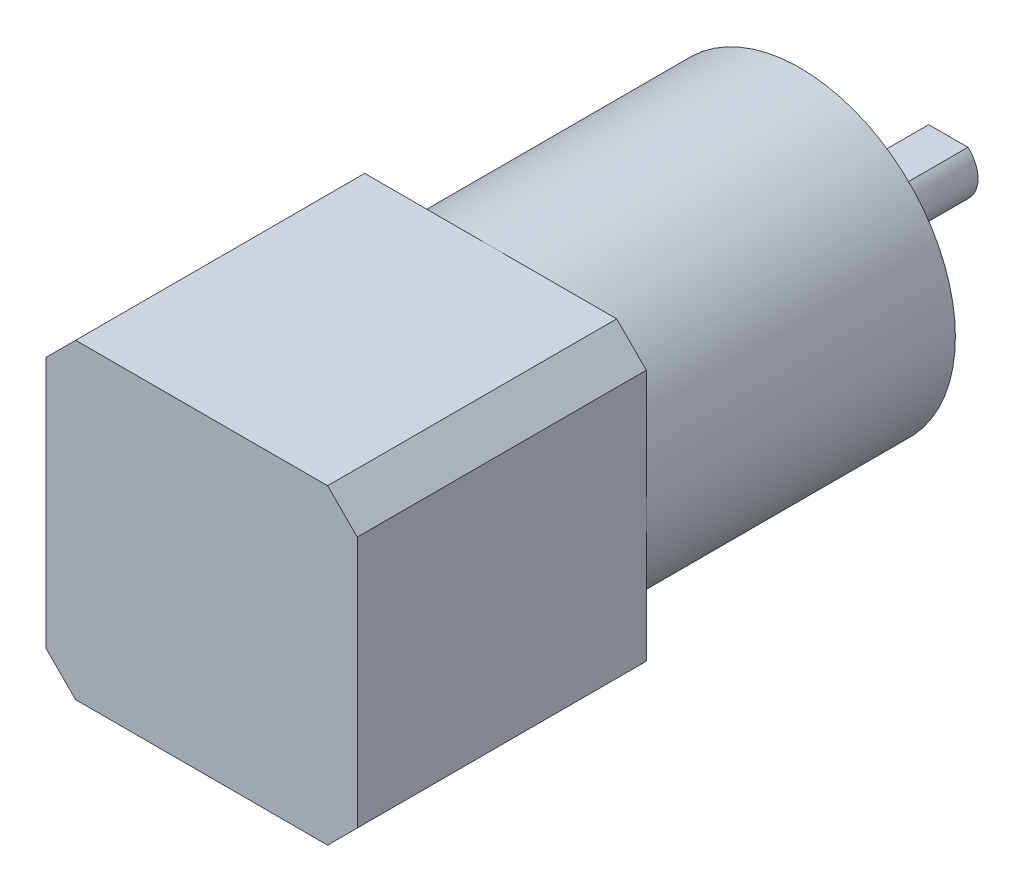
from build123d import *

# Parameters (mm, degrees)
SKETCH1_W           = 42
SKETCH1_H           = 42
BOSS_EXTRUDE1_DEPTH = 39
CHAMFER1_SIZE       = 4
SKETCH2_R           = 20.95
BOSS_EXTRUDE2_DEPTH = 41.75
SKETCH3_R           = 4
BOSS_EXTRUDE3_DEPTH = 20
CUT_EXTRUDE1_START  = -15
CUT_EXTRUDE1_DEPTH  = 15
SKETCH5_R           = 2
CUT_EXTRUDE2_DEPTH  = 20


with BuildPart() as part:
    # Sketch1 → Boss-Extrude1 (new body)
    with BuildSketch(Plane.XY):
        Rectangle(SKETCH1_W, SKETCH1_H)
    extrude(amount=BOSS_EXTRUDE1_DEPTH)

    # Chamfer1
    chamfer1_edges = [part.edges().sort_by_distance(p)[0] for p in [
        (21, -21, 19.5),
        (-21, -21, 19.5),
        (-21, 21, 19.5),
        (21, 21, 19.5),
    ]]
    chamfer(chamfer1_edges, length=CHAMFER1_SIZE)

    # Sketch2 → Boss-Extrude2 (add)
    with BuildSketch(Plane(origin=(0, 0, 0), x_dir=(-1, 0, 0), z_dir=(0, 0, -1))):
        with Locations(Location((0, 0, 0), (0, 0, 180))):
            Circle(SKETCH2_R)
    extrude(amount=BOSS_EXTRUDE2_DEPTH)

    # Sketch3 → Boss-Extrude3 (add)
    with BuildSketch(Plane(origin=(0, 0, -41.75), x_dir=(-1, 0, 0), z_dir=(0, 0, -1))):
        Circle(SKETCH3_R)
    extrude(amount=BOSS_EXTRUDE3_DEPTH)

    # Sketch4 → Cut-Extrude1 (cut)
    with BuildSketch(Plane(origin=(0, 0, -61.75), x_dir=(-1, 0, 0), z_dir=(0, 0, -1)).offset(CUT_EXTRUDE1_START)):
        with BuildLine():
            Line((-2.645751311, 3), (2.645751311, 3))
            ThreePointArc((2.645751311, 3), (0, 4), (-2.645751311, 3))
        make_face()
    extrude(amount=CUT_EXTRUDE1_DEPTH, mode=Mode.SUBTRACT)

    # Sketch5 → Cut-Extrude2 (cut)
    with BuildSketch(Plane(origin=(0, 0, -41.75), x_dir=(-1, 0, 0), z_dir=(0, 0, -1))):
        with Locations((12.02081528, 12.02081528)):
            Circle(SKETCH5_R)
        with Locations((12.02081528, -12.02081528)):
            Circle(SKETCH5_R)
        with Locations((-12.02081528, -12.02081528)):
            Circle(SKETCH5_R)
        with Locations((-12.02081528, 12.02081528)):
            Circle(SKETCH5_R)
    extrude(amount=-CUT_EXTRUDE2_DEPTH, mode=Mode.SUBTRACT)


solid = part.part
